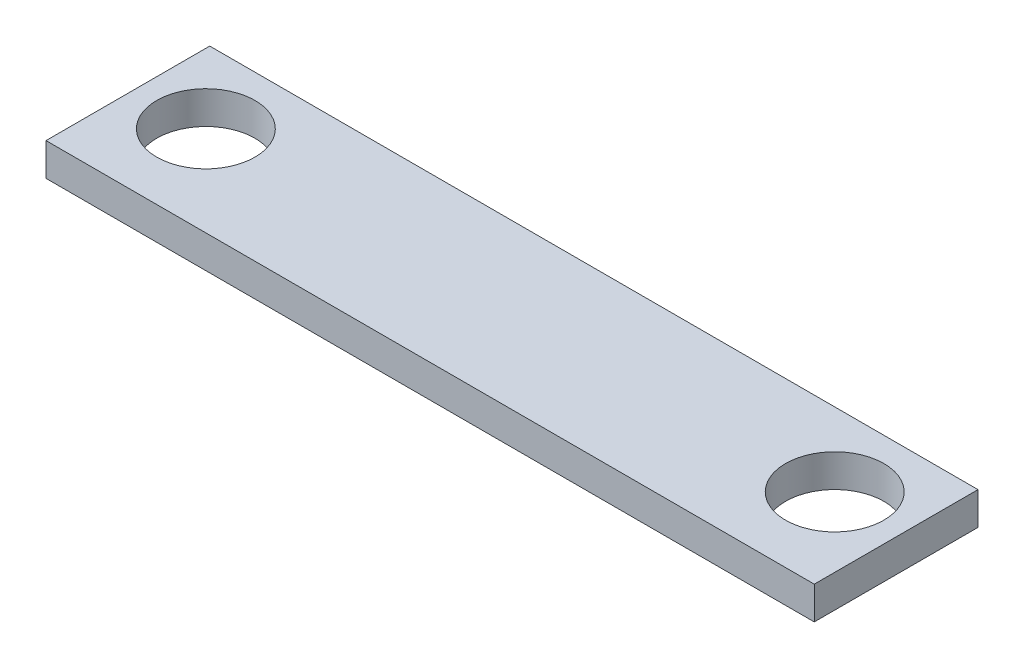
from build123d import *

# Parameters (mm, degrees)
SKETCH2_W           = 23.46
SKETCH2_H           = 5
EXTRUDE_THIN1_DEPTH = 1
SKETCH3_R           = 1.5
CUT_EXTRUDE1_DEPTH  = 13.790344014


with BuildPart() as part:
    # Sketch2 → Extrude-Thin1 (new body)
    with BuildSketch(Plane(origin=(0, 0, 0), x_dir=(1, 0, 0), z_dir=(0, 1, 0))):
        with Locations((0, -2.5)):
            Rectangle(SKETCH2_W, SKETCH2_H)
    extrude(amount=EXTRUDE_THIN1_DEPTH)

    # Sketch3 → Cut-Extrude1 (cut, through all)
    with BuildSketch(Plane(origin=(0, 1, 0), x_dir=(1, 0, 0), z_dir=(0, 1, 0))):
        with Locations(Location((-9.601393593, -2.247331748, 0), (0, 0, 270))):
            Circle(SKETCH3_R)
        with Locations(Location((9.601393593, -2.247331748, 0), (0, 0, 90))):
            Circle(SKETCH3_R)
    extrude(amount=-CUT_EXTRUDE1_DEPTH, mode=Mode.SUBTRACT)


solid = part.part
